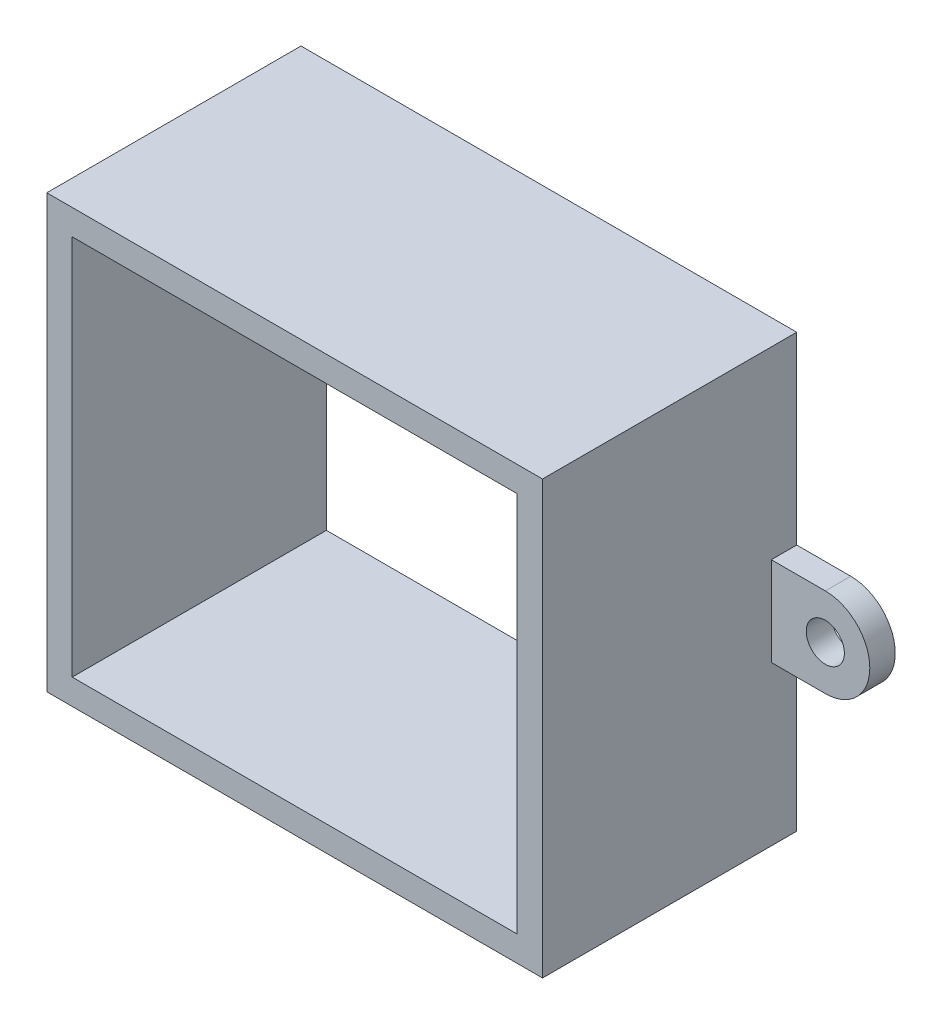
from build123d import *

# Parameters (mm, degrees)
SKETCH1_W           = 35
SKETCH1_H           = 30
BOSS_EXTRUDE1_DEPTH = 20
SKETCH1_3_R         = 1.5
BOSS_EXTRUDE2_DEPTH = 2


with BuildPart() as part:
    # Sketch1 → Boss-Extrude1 (new body)
    with BuildSketch(Plane.XY):
        Polygon((37, 32), (-2, 32), (-2, 17.5), (-2, 10.5), (-2, -2), (37, -2), (37, 10.5), (37, 17.5), align=None)
        with Locations((17.5, 15)):
            Rectangle(SKETCH1_W, SKETCH1_H, mode=Mode.SUBTRACT)
    extrude(amount=BOSS_EXTRUDE1_DEPTH)

    # Sketch1<3> → Boss-Extrude2 (add)
    # profile 1 of 2: a face of its own
    with BuildSketch(Plane.XY):
        with BuildLine():
            Line((-2, 10.5), (-2, 17.5))
            Line((-2, 17.5), (-6.25, 17.5))
            ThreePointArc((-6.25, 17.5), (-9.75, 14), (-6.25, 10.5))
            Line((-6.25, 10.5), (-2, 10.5))
        make_face()
        with Locations((-6.25, 14)):
            Circle(SKETCH1_3_R, mode=Mode.SUBTRACT)
    # profile 2 of 2: a face of its own
    with BuildSketch(Plane.XY):
        with BuildLine():
            Line((41.25, 17.5), (37, 17.5))
            Line((37, 17.5), (37, 10.5))
            Line((37, 10.5), (41.25, 10.5))
            ThreePointArc((41.25, 10.5), (44.75, 14), (41.25, 17.5))
        make_face()
        with Locations((41.25, 14)):
            Circle(SKETCH1_3_R, mode=Mode.SUBTRACT)
    extrude(amount=BOSS_EXTRUDE2_DEPTH)


solid = part.part
